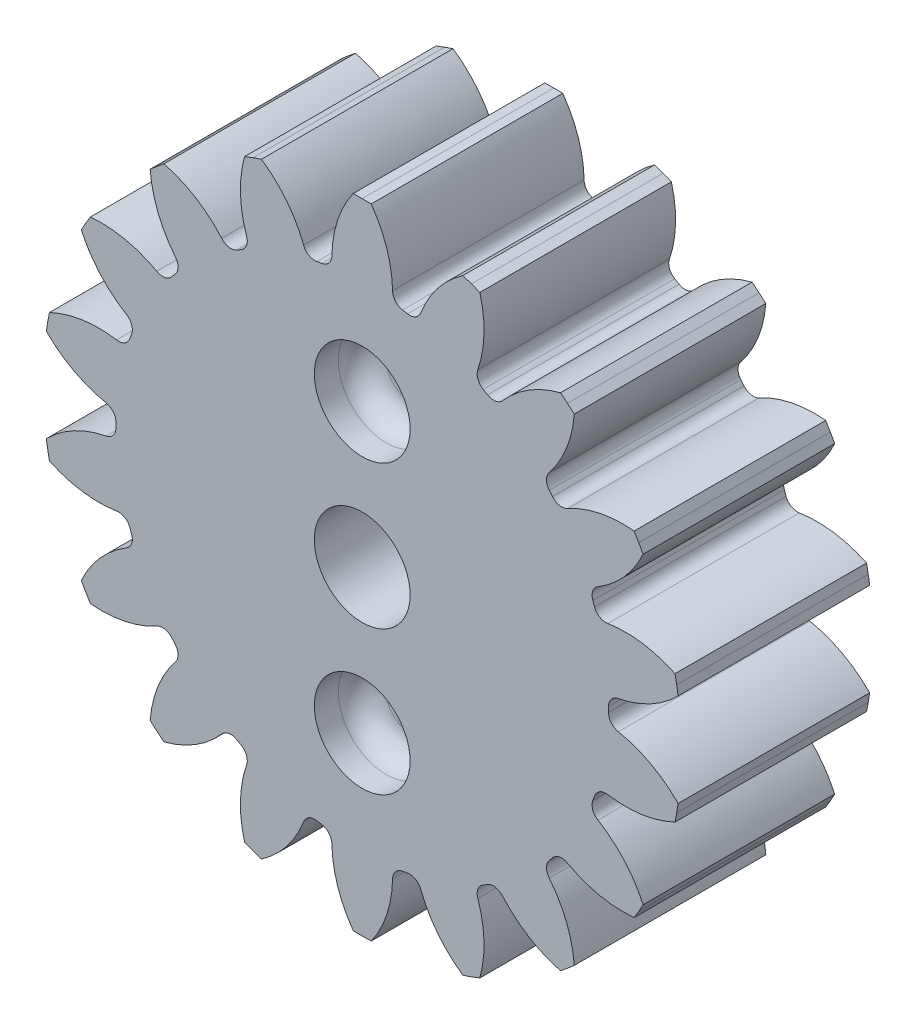
from build123d import *

# Parameters (mm, degrees)
SKETCH1_R           = 6.35
BOSS_EXTRUDE1_DEPTH = 25.4
SKETCH2_R           = 6.35
CUT_EXTRUDE1_DEPTH  = 6.35
CUT_EXTRUDE2_START  = -6.35
SKETCH3_R           = 6.35
CUT_EXTRUDE2_DEPTH  = 6.35
FILLET1_R           = 3.175


with BuildPart() as part:
    # Sketch1 → Boss-Extrude1 (new body)
    with BuildSketch(Plane.XY):
        with BuildLine():
            Line((1.1938, 42.32496744), (0, 42.3418))
            Line((0, 42.3418), (-1.1938, 42.32496744))
            ThreePointArc((-1.1938, 42.32496744), (-3.255458447, 38.265423939), (-4.0259, 33.778025048))
            ThreePointArc((-4.0259, 33.778025048), (-4.026161122, 33.749348192), (-4.026944402, 33.720680845))
            ThreePointArc((-4.026944402, 33.720680845), (-4.41826532, 32.737908099), (-5.343101039, 32.224436359))
            ThreePointArc((-5.343101039, 32.224436359), (-5.672113535, 32.168154367), (-6.000533724, 32.108513239))
            ThreePointArc((-6.000533724, 32.108513239), (-7.045212702, 32.274706398), (-7.749062157, 33.06437106))
            ThreePointArc((-7.749062157, 33.06437106), (-7.759603009, 33.091041656), (-7.769656446, 33.117899777))
            ThreePointArc((-7.769656446, 33.117899777), (-10.0284155, 37.071168871), (-13.354186379, 40.180763226))
            Line((-13.354186379, 40.180763226), (-14.481748505, 39.788277011))
            Line((-14.481748505, 39.788277011), (-15.597796481, 39.364155931))
            ThreePointArc((-15.597796481, 39.364155931), (-16.14667606, 34.844304142), (-15.33587349, 30.364021987))
            ThreePointArc((-15.33587349, 30.364021987), (-15.326310802, 30.336985248), (-15.317242035, 30.309778857))
            ThreePointArc((-15.317242035, 30.309778857), (-15.348835338, 29.252434922), (-16.04227896, 28.453616872))
            ThreePointArc((-16.04227896, 28.453616872), (-16.3322, 28.288200199), (-16.620415561, 28.11982955))
            ThreePointArc((-16.620415561, 28.11982955), (-17.658934096, 27.918698783), (-18.590417456, 28.420010146))
            ThreePointArc((-18.590417456, 28.420010146), (-18.609444498, 28.441467125), (-18.628077657, 28.463267025))
            ThreePointArc((-18.628077657, 28.463267025), (-22.102714534, 31.405583726), (-26.291460795, 33.190165961))
            Line((-26.291460795, 33.190165961), (-27.216784412, 32.435700602))
            Line((-27.216784412, 32.435700602), (-28.120468507, 31.655446264))
            ThreePointArc((-28.120468507, 31.655446264), (-27.090366241, 27.220447018), (-24.796114304, 23.28766975))
            ThreePointArc((-24.796114304, 23.28766975), (-24.777881207, 23.265534157), (-24.760054219, 23.243070213))
            ThreePointArc((-24.760054219, 23.243070213), (-24.42810929, 22.238686374), (-24.80652128, 21.250871261))
            ThreePointArc((-24.80652128, 21.250871261), (-25.022382108, 20.996271598), (-25.23562999, 20.739479414))
            ThreePointArc((-25.23562999, 20.739479414), (-26.14272742, 20.195284057), (-27.189494044, 20.347776574))
            ThreePointArc((-27.189494044, 20.347776574), (-27.214712334, 20.361431907), (-27.239677781, 20.375544197))
            ThreePointArc((-27.239677781, 20.375544197), (-31.511099994, 21.952021686), (-36.057597017, 22.196344847))
            Line((-36.057597017, 22.196344847), (-36.669074442, 21.1709))
            Line((-36.669074442, 21.1709), (-37.251397017, 20.128622593))
            ThreePointArc((-37.251397017, 20.128622593), (-34.766558441, 16.313402253), (-31.265577781, 13.402480851))
            ThreePointArc((-31.265577781, 13.402480851), (-31.240873456, 13.387916284), (-31.216438446, 13.372904271))
            ThreePointArc((-31.216438446, 13.372904271), (-30.56099274, 12.542624041), (-30.578731029, 11.484956945))
            ThreePointArc((-30.578731029, 11.484956945), (-30.694495642, 11.17188277), (-30.807055004, 10.857641978))
            ThreePointArc((-30.807055004, 10.857641978), (-31.473321992, 10.036020024), (-32.509116376, 9.821300846))
            ThreePointArc((-32.509116376, 9.821300846), (-32.537484216, 9.825507499), (-32.56577075, 9.830230028))
            ThreePointArc((-32.56577075, 9.830230028), (-37.11878174, 9.850721853), (-41.474654886, 8.525316961))
            Line((-41.474654886, 8.525316961), (-41.698532916, 7.352576409))
            Line((-41.698532916, 7.352576409), (-41.889257275, 6.17398997))
            ThreePointArc((-41.889257275, 6.17398997), (-38.249390594, 3.438720416), (-33.963951147, 1.900754962))
            ThreePointArc((-33.963951147, 1.900754962), (-33.9357553, 1.895518123), (-33.90765949, 1.88976871))
            ThreePointArc((-33.90765949, 1.88976871), (-33.007769434, 1.333736139), (-32.662694521, 0.333787322))
            ThreePointArc((-32.662694521, 0.333787322), (-32.6644, 0), (-32.662694521, -0.333787322))
            ThreePointArc((-32.662694521, -0.333787322), (-33.007769434, -1.333736139), (-33.90765949, -1.88976871))
            ThreePointArc((-33.90765949, -1.88976871), (-33.9357553, -1.895518123), (-33.963951147, -1.900754962))
            ThreePointArc((-33.963951147, -1.900754962), (-38.249390594, -3.438720416), (-41.889257275, -6.17398997))
            Line((-41.889257275, -6.17398997), (-41.698532916, -7.352576409))
            Line((-41.698532916, -7.352576409), (-41.474654886, -8.525316961))
            ThreePointArc((-41.474654886, -8.525316961), (-37.11878174, -9.850721853), (-32.56577075, -9.830230028))
            ThreePointArc((-32.56577075, -9.830230028), (-32.537484216, -9.825507499), (-32.509116376, -9.821300846))
            ThreePointArc((-32.509116376, -9.821300846), (-31.473321992, -10.036020024), (-30.807055004, -10.857641978))
            ThreePointArc((-30.807055004, -10.857641978), (-30.694495642, -11.17188277), (-30.578731029, -11.484956945))
            ThreePointArc((-30.578731029, -11.484956945), (-30.56099274, -12.542624041), (-31.216438446, -13.372904271))
            ThreePointArc((-31.216438446, -13.372904271), (-31.240873456, -13.387916284), (-31.265577781, -13.402480851))
            ThreePointArc((-31.265577781, -13.402480851), (-34.766558441, -16.313402253), (-37.251397017, -20.128622593))
            Line((-37.251397017, -20.128622593), (-36.669074442, -21.1709))
            Line((-36.669074442, -21.1709), (-36.057597017, -22.196344847))
            ThreePointArc((-36.057597017, -22.196344847), (-31.511099994, -21.952021686), (-27.239677781, -20.375544197))
            ThreePointArc((-27.239677781, -20.375544197), (-27.214712334, -20.361431907), (-27.189494044, -20.347776574))
            ThreePointArc((-27.189494044, -20.347776574), (-26.14272742, -20.195284057), (-25.23562999, -20.739479414))
            ThreePointArc((-25.23562999, -20.739479414), (-25.022382108, -20.996271598), (-24.80652128, -21.250871261))
            ThreePointArc((-24.80652128, -21.250871261), (-24.42810929, -22.238686374), (-24.760054219, -23.243070213))
            ThreePointArc((-24.760054219, -23.243070213), (-24.777881207, -23.265534157), (-24.796114304, -23.28766975))
            ThreePointArc((-24.796114304, -23.28766975), (-27.090366241, -27.220447018), (-28.120468507, -31.655446264))
            Line((-28.120468507, -31.655446264), (-27.216784412, -32.435700602))
            Line((-27.216784412, -32.435700602), (-26.291460795, -33.190165961))
            ThreePointArc((-26.291460795, -33.190165961), (-22.102714534, -31.405583726), (-18.628077657, -28.463267025))
            ThreePointArc((-18.628077657, -28.463267025), (-18.609444498, -28.441467125), (-18.590417456, -28.420010146))
            ThreePointArc((-18.590417456, -28.420010146), (-17.658934096, -27.918698783), (-16.620415561, -28.11982955))
            ThreePointArc((-16.620415561, -28.11982955), (-16.3322, -28.288200199), (-16.04227896, -28.453616872))
            ThreePointArc((-16.04227896, -28.453616872), (-15.348835338, -29.252434922), (-15.317242035, -30.309778857))
            ThreePointArc((-15.317242035, -30.309778857), (-15.326310802, -30.336985248), (-15.33587349, -30.364021987))
            ThreePointArc((-15.33587349, -30.364021987), (-16.14667606, -34.844304142), (-15.597796481, -39.364155931))
            Line((-15.597796481, -39.364155931), (-14.481748505, -39.788277011))
            Line((-14.481748505, -39.788277011), (-13.354186379, -40.180763226))
            ThreePointArc((-13.354186379, -40.180763226), (-10.0284155, -37.071168871), (-7.769656446, -33.117899777))
            ThreePointArc((-7.769656446, -33.117899777), (-7.759603009, -33.091041656), (-7.749062157, -33.06437106))
            ThreePointArc((-7.749062157, -33.06437106), (-7.045212702, -32.274706398), (-6.000533724, -32.108513239))
            ThreePointArc((-6.000533724, -32.108513239), (-5.672113535, -32.168154367), (-5.343101039, -32.224436359))
            ThreePointArc((-5.343101039, -32.224436359), (-4.41826532, -32.737908099), (-4.026944402, -33.720680845))
            ThreePointArc((-4.026944402, -33.720680845), (-4.026161122, -33.749348192), (-4.0259, -33.778025048))
            ThreePointArc((-4.0259, -33.778025048), (-3.255458447, -38.265423939), (-1.1938, -42.32496744))
            Line((-1.1938, -42.32496744), (0, -42.3418))
            Line((0, -42.3418), (1.1938, -42.32496744))
            ThreePointArc((1.1938, -42.32496744), (3.255458447, -38.265423939), (4.0259, -33.778025048))
            ThreePointArc((4.0259, -33.778025048), (4.026161122, -33.749348192), (4.026944402, -33.720680845))
            ThreePointArc((4.026944402, -33.720680845), (4.41826532, -32.737908099), (5.343101039, -32.224436359))
            ThreePointArc((5.343101039, -32.224436359), (5.672113535, -32.168154367), (6.000533724, -32.108513239))
            ThreePointArc((6.000533724, -32.108513239), (7.045212702, -32.274706398), (7.749062157, -33.06437106))
            ThreePointArc((7.749062157, -33.06437106), (7.759603009, -33.091041656), (7.769656446, -33.117899777))
            ThreePointArc((7.769656446, -33.117899777), (10.0284155, -37.071168871), (13.354186379, -40.180763226))
            Line((13.354186379, -40.180763226), (14.481748505, -39.788277011))
            Line((14.481748505, -39.788277011), (15.597796481, -39.364155931))
            ThreePointArc((15.597796481, -39.364155931), (16.14667606, -34.844304142), (15.33587349, -30.364021987))
            ThreePointArc((15.33587349, -30.364021987), (15.326310802, -30.336985248), (15.317242035, -30.309778857))
            ThreePointArc((15.317242035, -30.309778857), (15.348835338, -29.252434922), (16.04227896, -28.453616872))
            ThreePointArc((16.04227896, -28.453616872), (16.3322, -28.288200199), (16.620415561, -28.11982955))
            ThreePointArc((16.620415561, -28.11982955), (17.658934096, -27.918698783), (18.590417456, -28.420010146))
            ThreePointArc((18.590417456, -28.420010146), (18.609444498, -28.441467125), (18.628077657, -28.463267025))
            ThreePointArc((18.628077657, -28.463267025), (22.102714534, -31.405583726), (26.291460795, -33.190165961))
            Line((26.291460795, -33.190165961), (27.216784412, -32.435700602))
            Line((27.216784412, -32.435700602), (28.120468507, -31.655446264))
            ThreePointArc((28.120468507, -31.655446264), (27.090366241, -27.220447018), (24.796114304, -23.28766975))
            ThreePointArc((24.796114304, -23.28766975), (24.777881207, -23.265534157), (24.760054219, -23.243070213))
            ThreePointArc((24.760054219, -23.243070213), (24.42810929, -22.238686374), (24.80652128, -21.250871261))
            ThreePointArc((24.80652128, -21.250871261), (25.022382108, -20.996271598), (25.23562999, -20.739479414))
            ThreePointArc((25.23562999, -20.739479414), (26.14272742, -20.195284057), (27.189494044, -20.347776574))
            ThreePointArc((27.189494044, -20.347776574), (27.214712334, -20.361431907), (27.239677781, -20.375544197))
            ThreePointArc((27.239677781, -20.375544197), (31.511099994, -21.952021686), (36.057597017, -22.196344847))
            Line((36.057597017, -22.196344847), (36.669074442, -21.1709))
            Line((36.669074442, -21.1709), (37.251397017, -20.128622593))
            ThreePointArc((37.251397017, -20.128622593), (34.766558441, -16.313402253), (31.265577781, -13.402480851))
            ThreePointArc((31.265577781, -13.402480851), (31.240873456, -13.387916284), (31.216438446, -13.372904271))
            ThreePointArc((31.216438446, -13.372904271), (30.56099274, -12.542624041), (30.578731029, -11.484956945))
            ThreePointArc((30.578731029, -11.484956945), (30.694495642, -11.17188277), (30.807055004, -10.857641978))
            ThreePointArc((30.807055004, -10.857641978), (31.473321992, -10.036020024), (32.509116376, -9.821300846))
            ThreePointArc((32.509116376, -9.821300846), (32.537484216, -9.825507499), (32.56577075, -9.830230028))
            ThreePointArc((32.56577075, -9.830230028), (37.11878174, -9.850721853), (41.474654886, -8.525316961))
            Line((41.474654886, -8.525316961), (41.698532916, -7.352576409))
            Line((41.698532916, -7.352576409), (41.889257275, -6.17398997))
            ThreePointArc((41.889257275, -6.17398997), (38.249390594, -3.438720416), (33.963951147, -1.900754962))
            ThreePointArc((33.963951147, -1.900754962), (33.9357553, -1.895518123), (33.90765949, -1.88976871))
            ThreePointArc((33.90765949, -1.88976871), (33.007769434, -1.333736139), (32.662694521, -0.333787322))
            ThreePointArc((32.662694521, -0.333787322), (32.6644, 0), (32.662694521, 0.333787322))
            ThreePointArc((32.662694521, 0.333787322), (33.007769434, 1.333736139), (33.90765949, 1.88976871))
            ThreePointArc((33.90765949, 1.88976871), (33.9357553, 1.895518123), (33.963951147, 1.900754962))
            ThreePointArc((33.963951147, 1.900754962), (38.249390594, 3.438720416), (41.889257275, 6.17398997))
            Line((41.889257275, 6.17398997), (41.698532916, 7.352576409))
            Line((41.698532916, 7.352576409), (41.474654886, 8.525316961))
            ThreePointArc((41.474654886, 8.525316961), (37.11878174, 9.850721853), (32.56577075, 9.830230028))
            ThreePointArc((32.56577075, 9.830230028), (32.537484216, 9.825507499), (32.509116376, 9.821300846))
            ThreePointArc((32.509116376, 9.821300846), (31.473321992, 10.036020024), (30.807055004, 10.857641978))
            ThreePointArc((30.807055004, 10.857641978), (30.694495642, 11.17188277), (30.578731029, 11.484956945))
            ThreePointArc((30.578731029, 11.484956945), (30.56099274, 12.542624041), (31.216438446, 13.372904271))
            ThreePointArc((31.216438446, 13.372904271), (31.240873456, 13.387916284), (31.265577781, 13.402480851))
            ThreePointArc((31.265577781, 13.402480851), (34.766558441, 16.313402253), (37.251397017, 20.128622593))
            Line((37.251397017, 20.128622593), (36.669074442, 21.1709))
            Line((36.669074442, 21.1709), (36.057597017, 22.196344847))
            ThreePointArc((36.057597017, 22.196344847), (31.511099994, 21.952021686), (27.239677781, 20.375544197))
            ThreePointArc((27.239677781, 20.375544197), (27.214712334, 20.361431907), (27.189494044, 20.347776574))
            ThreePointArc((27.189494044, 20.347776574), (26.14272742, 20.195284057), (25.23562999, 20.739479414))
            ThreePointArc((25.23562999, 20.739479414), (25.022382108, 20.996271598), (24.80652128, 21.250871261))
            ThreePointArc((24.80652128, 21.250871261), (24.42810929, 22.238686374), (24.760054219, 23.243070213))
            ThreePointArc((24.760054219, 23.243070213), (24.777881207, 23.265534157), (24.796114304, 23.28766975))
            ThreePointArc((24.796114304, 23.28766975), (27.090366241, 27.220447018), (28.120468507, 31.655446264))
            Line((28.120468507, 31.655446264), (27.216784412, 32.435700602))
            Line((27.216784412, 32.435700602), (26.291460795, 33.190165961))
            ThreePointArc((26.291460795, 33.190165961), (22.102714534, 31.405583726), (18.628077657, 28.463267025))
            ThreePointArc((18.628077657, 28.463267025), (18.609444498, 28.441467125), (18.590417456, 28.420010146))
            ThreePointArc((18.590417456, 28.420010146), (17.658934096, 27.918698783), (16.620415561, 28.11982955))
            ThreePointArc((16.620415561, 28.11982955), (16.3322, 28.288200199), (16.04227896, 28.453616872))
            ThreePointArc((16.04227896, 28.453616872), (15.348835338, 29.252434922), (15.317242035, 30.309778857))
            ThreePointArc((15.317242035, 30.309778857), (15.326310802, 30.336985248), (15.33587349, 30.364021987))
            ThreePointArc((15.33587349, 30.364021987), (16.14667606, 34.844304142), (15.597796481, 39.364155931))
            Line((15.597796481, 39.364155931), (14.481748505, 39.788277011))
            Line((14.481748505, 39.788277011), (13.354186379, 40.180763226))
            ThreePointArc((13.354186379, 40.180763226), (10.0284155, 37.071168871), (7.769656446, 33.117899777))
            ThreePointArc((7.769656446, 33.117899777), (7.759603009, 33.091041656), (7.749062157, 33.06437106))
            ThreePointArc((7.749062157, 33.06437106), (7.045212702, 32.274706398), (6.000533724, 32.108513239))
            ThreePointArc((6.000533724, 32.108513239), (5.672113535, 32.168154367), (5.343101039, 32.224436359))
            ThreePointArc((5.343101039, 32.224436359), (4.41826532, 32.737908099), (4.026944402, 33.720680845))
            ThreePointArc((4.026944402, 33.720680845), (4.026161122, 33.749348192), (4.0259, 33.778025048))
            ThreePointArc((4.0259, 33.778025048), (3.255458447, 38.265423939), (1.1938, 42.32496744))
        make_face()
        Circle(SKETCH1_R, mode=Mode.SUBTRACT)
    extrude(amount=BOSS_EXTRUDE1_DEPTH)

    # Sketch2 → Cut-Extrude1 (cut)
    with BuildSketch(Plane.XY.offset(25.4)):
        with Locations((0, -19.05)):
            Circle(SKETCH2_R)
        with Locations((0, 19.05)):
            Circle(SKETCH2_R)
    extrude(amount=-CUT_EXTRUDE1_DEPTH, mode=Mode.SUBTRACT)

    # Sketch3 → Cut-Extrude2 (cut)
    with BuildSketch(Plane(origin=(0, 0, 0), x_dir=(-1, 0, 0), z_dir=(0, 0, -1)).offset(CUT_EXTRUDE2_START)):
        with Locations(Location((0, -19.05, 0), (0, 0, 180))):
            Circle(SKETCH3_R)
        with Locations(Location((0, 19.05, 0), (0, 0, 180))):
            Circle(SKETCH3_R)
    extrude(amount=CUT_EXTRUDE2_DEPTH, mode=Mode.SUBTRACT)

    # Fillet1
    fillet1_edges = [part.edges().sort_by_distance(p)[0] for p in [
        (-6.35, 19.05, 19.05),
        (-6.35, -19.05, 19.05),
        (-6.35, 19.05, 6.35),
        (-6.35, -19.05, 6.35),
    ]]
    fillet(fillet1_edges, radius=FILLET1_R)


solid = part.part
